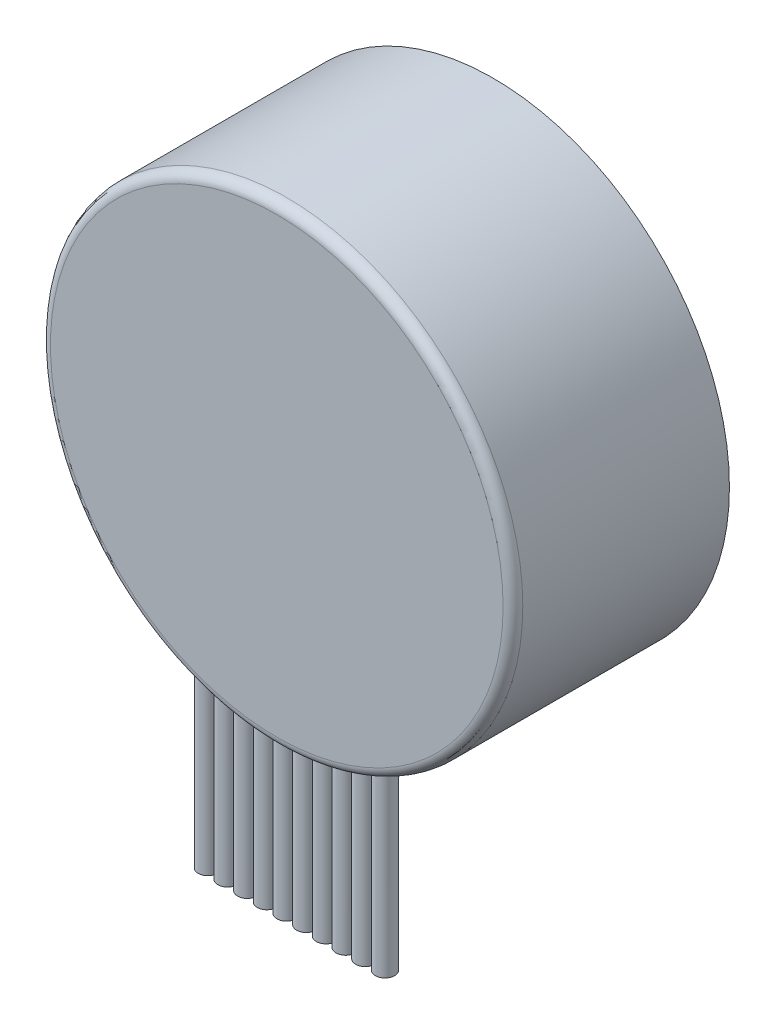
from build123d import *

# Parameters (mm, degrees)
ESQUISSE1_R        = 12
BOSS_EXTRU_1_DEPTH = 11
CONG_1_R           = 0.5
ESQUISSE2_R        = 0.49
BOSS_EXTRU_2_DEPTH = 20


with BuildPart() as part:
    # Esquisse1 → Boss.-Extru.1 (new body)
    with BuildSketch(Plane.XY):
        Circle(ESQUISSE1_R)
    extrude(amount=BOSS_EXTRU_1_DEPTH)

    # Congé1
    cong_1_edges = [part.edges().sort_by_distance(p)[0] for p in [
        (-12, 0, 11),
    ]]
    fillet(cong_1_edges, radius=CONG_1_R)

    # Esquisse2 → Boss.-Extru.2 (add)
    with BuildSketch(Plane(origin=(0, 0, 0), x_dir=(1, 0, 0), z_dir=(0, 1, 0))):
        with Locations(Location((0.5, -10, 0), (0, 0, 270))):
            Circle(ESQUISSE2_R)
        with Locations(Location((1.5, -10, 0), (0, 0, 270))):
            Circle(ESQUISSE2_R)
        with Locations(Location((2.5, -10, 0), (0, 0, 270))):
            Circle(ESQUISSE2_R)
        with Locations(Location((3.5, -10, 0), (0, 0, 270))):
            Circle(ESQUISSE2_R)
        with Locations(Location((4.5, -10, 0), (0, 0, 270))):
            Circle(ESQUISSE2_R)
        with Locations(Location((-0.5, -10, 0), (0, 0, 270))):
            Circle(ESQUISSE2_R)
        with Locations(Location((-1.5, -10, 0), (0, 0, 270))):
            Circle(ESQUISSE2_R)
        with Locations(Location((-2.5, -10, 0), (0, 0, 270))):
            Circle(ESQUISSE2_R)
        with Locations(Location((-3.5, -10, 0), (0, 0, 270))):
            Circle(ESQUISSE2_R)
        with Locations(Location((-4.5, -10, 0), (0, 0, 270))):
            Circle(ESQUISSE2_R)
    extrude(amount=-BOSS_EXTRU_2_DEPTH)


solid = part.part
